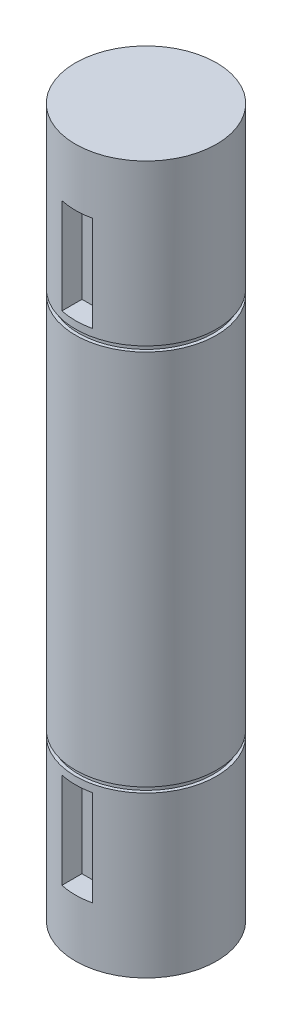
from build123d import *

# Parameters (mm, degrees)
SKETCH1_R           = 32.5
BOSS_EXTRUDE1_DEPTH = 326
SKETCH2_R           = 53.453114337
SKETCH2_R_2         = 31
CUT_EXTRUDE1_DEPTH  = 2.42
CUT_EXTRUDE2_START  = 2.42
SKETCH3_R           = 95.953037666
SKETCH3_R_2         = 31
CUT_EXTRUDE2_DEPTH  = 2.42
SKETCH5_W           = 14
SKETCH5_H           = 44
CUT_EXTRUDE3_DEPTH  = 10


with BuildPart() as part:
    # Sketch1 → Boss-Extrude1 (new body)
    with BuildSketch(Plane(origin=(0, 0, 0), x_dir=(1, 0, 0), z_dir=(0, 1, 0))):
        Circle(SKETCH1_R)
    extrude(amount=BOSS_EXTRUDE1_DEPTH)

    # Sketch2 → Cut-Extrude1 (cut)
    with BuildSketch(Plane(origin=(0, 73.8, 0), x_dir=(1, 0, 0), z_dir=(0, 1, 0))):
        Circle(SKETCH2_R)
        Circle(SKETCH2_R_2, mode=Mode.SUBTRACT)
    extrude(amount=CUT_EXTRUDE1_DEPTH, mode=Mode.SUBTRACT)

    # Sketch3 → Cut-Extrude2 (cut)
    with BuildSketch(Plane(origin=(0, 252.2, 0), x_dir=(-1, 0, 0), z_dir=(0, -1, 0)).offset(CUT_EXTRUDE2_START)):
        Circle(SKETCH3_R)
        Circle(SKETCH3_R_2, mode=Mode.SUBTRACT)
    extrude(amount=-CUT_EXTRUDE2_DEPTH, mode=Mode.SUBTRACT)

    # Sketch5 → Cut-Extrude3 (cut)
    with BuildSketch(Plane.XY.offset(32.5)):
        with Locations((0, 277.6)):
            Rectangle(SKETCH5_W, SKETCH5_H)
        with Locations((0, 48.4)):
            Rectangle(SKETCH5_W, SKETCH5_H)
    extrude(amount=-CUT_EXTRUDE3_DEPTH, mode=Mode.SUBTRACT)


solid = part.part
